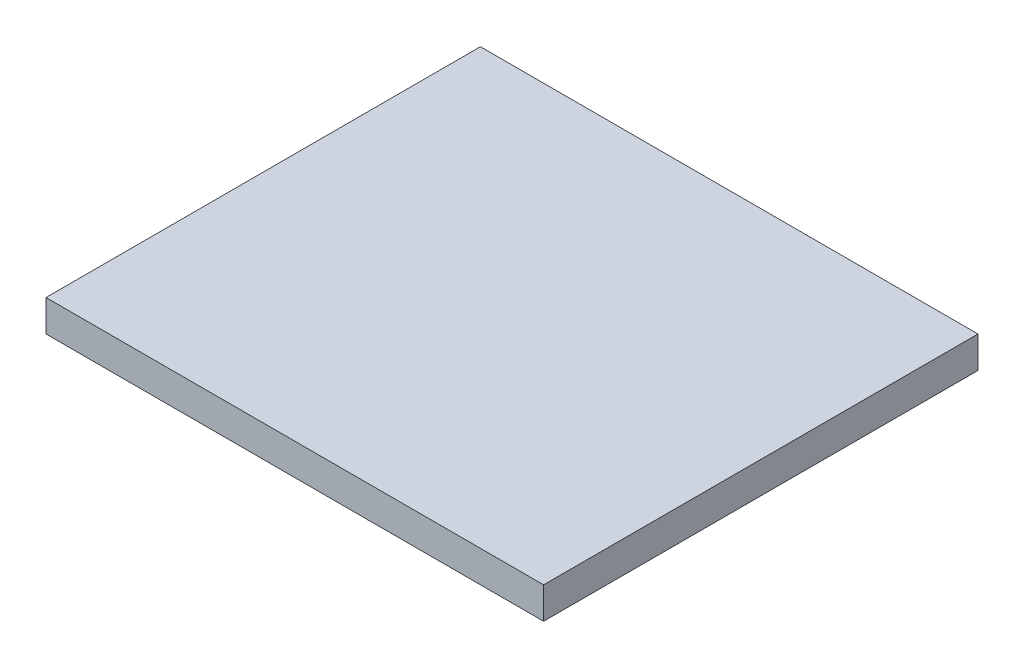
from build123d import *

# Parameters (mm, degrees)
SKETCH1_W           = 63
SKETCH1_H           = 55
BOSS_EXTRUDE1_DEPTH = 4


with BuildPart() as part:
    # Sketch1 → Boss-Extrude1 (new body)
    with BuildSketch(Plane(origin=(0, 0, 0), x_dir=(1, 0, 0), z_dir=(0, 1, 0))):
        Rectangle(SKETCH1_W, SKETCH1_H)
    extrude(amount=BOSS_EXTRUDE1_DEPTH)


solid = part.part
